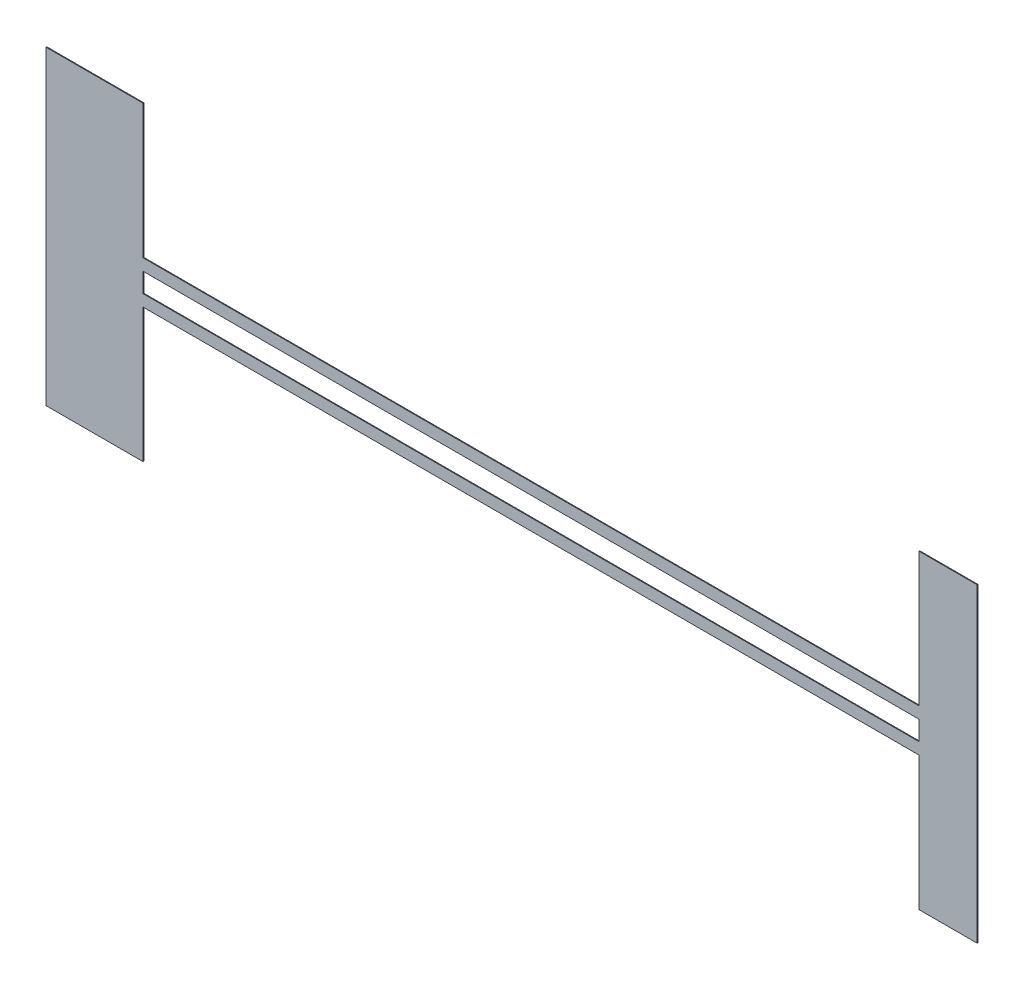
from build123d import *

# Parameters (mm, degrees)
SKETCH2_W           = 10000
SKETCH2_H           = 250
BOSS_EXTRUDE1_DEPTH = 10


with BuildPart() as part:
    # Sketch2 → Boss-Extrude1 (new body)
    with BuildSketch(Plane.XY):
        Polygon((250, 2000), (250, 275), (10250, 275), (10250, 2000), (11000, 2000), (11000, -2000), (10250, -2000), (10250, -275), (250, -275), (250, -2000), (-1000, -2000), (-1000, 2000), align=None)
        with Locations((5250, 0)):
            Rectangle(SKETCH2_W, SKETCH2_H, mode=Mode.SUBTRACT)
    extrude(amount=-BOSS_EXTRUDE1_DEPTH)


solid = part.part
